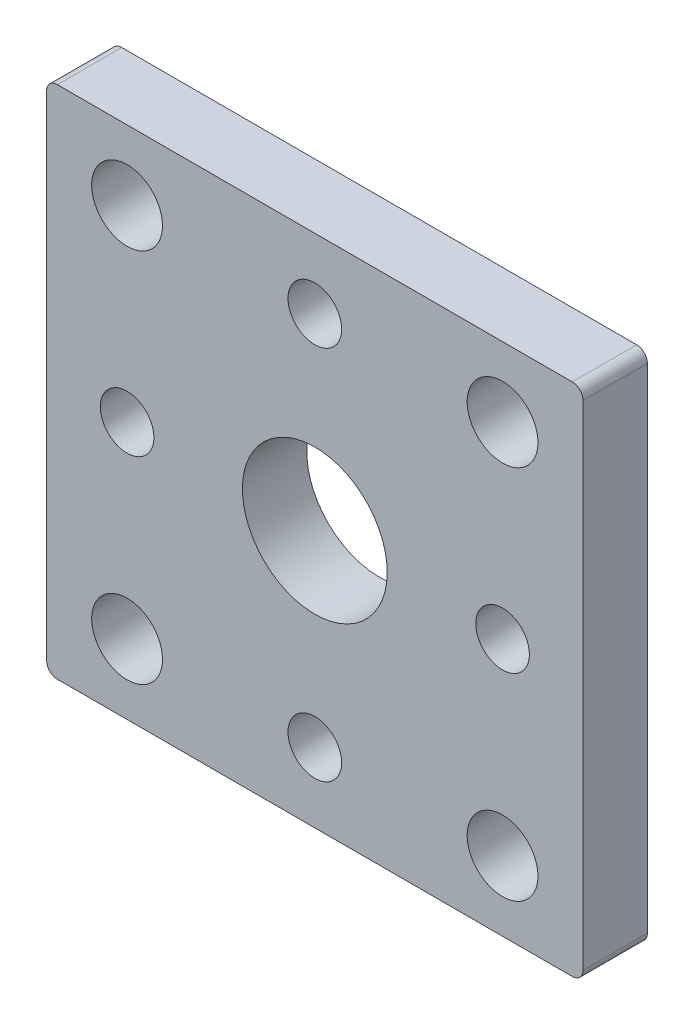
from build123d import *

# Parameters (mm, degrees)
SKETCH_1_W          = 50
SKETCH_1_H          = 48
EXTRUDE_1_DEPTH     = 6
FILLET_1_R          = 1
SKETCH_2_R          = 3.3
CUT_EXTRUDE_1_DEPTH = 70.570108524
HOLE_WIZARD_M6_2_D  = 5


with BuildPart() as part:
    # 草图1 → 凸台-拉伸1 (new body)
    with BuildSketch(Plane.XY):
        with Locations((25, -24)):
            Rectangle(SKETCH_1_W, SKETCH_1_H)
    extrude(amount=EXTRUDE_1_DEPTH)

    # 圆角1
    fillet_1_edges = [part.edges().sort_by_distance(p)[0] for p in [
        (0, 0, 3),
        (50, 0, 3),
        (50, -48, 3),
        (0, -48, 3),
    ]]
    fillet(fillet_1_edges, radius=FILLET_1_R)

    # 草图2 → 切除-拉伸1 (cut, through all)
    with BuildSketch(Plane.XY.offset(6)):
        with Locations((7.5, -6.5)):
            Circle(SKETCH_2_R)
        with Locations((42.5, -6.5)):
            Circle(SKETCH_2_R)
        with Locations((42.5, -41.5)):
            Circle(SKETCH_2_R)
        with Locations((7.5, -41.5)):
            Circle(SKETCH_2_R)
        with BuildLine():
            Line((25, -24), (31.75, -24))
            ThreePointArc((31.75, -24), (29.772970773, -19.227029227), (25, -17.25))
            Line((25, -17.25), (25, -24))
        make_face()
        with BuildLine():
            Line((18.25, -24), (25, -24))
            Line((25, -24), (25, -17.25))
            ThreePointArc((25, -17.25), (20.227029227, -19.227029227), (18.25, -24))
        make_face()
        with BuildLine():
            ThreePointArc((25, -30.75), (29.772970773, -28.772970773), (31.75, -24))
            Line((31.75, -24), (25, -24))
            Line((25, -24), (25, -30.75))
        make_face()
        with BuildLine():
            Line((25, -30.75), (25, -24))
            Line((25, -24), (18.25, -24))
            ThreePointArc((18.25, -24), (20.227029227, -28.772970773), (25, -30.75))
        make_face()
    extrude(amount=-CUT_EXTRUDE_1_DEPTH, mode=Mode.SUBTRACT)

    # M6 螺纹孔2 (through all)
    with Locations(Plane.XY.offset(6)):
        with Locations((25, -6.5), (42.5, -24), (25, -41.5), (7.5, -24)):
            Hole(HOLE_WIZARD_M6_2_D / 2)


solid = part.part
